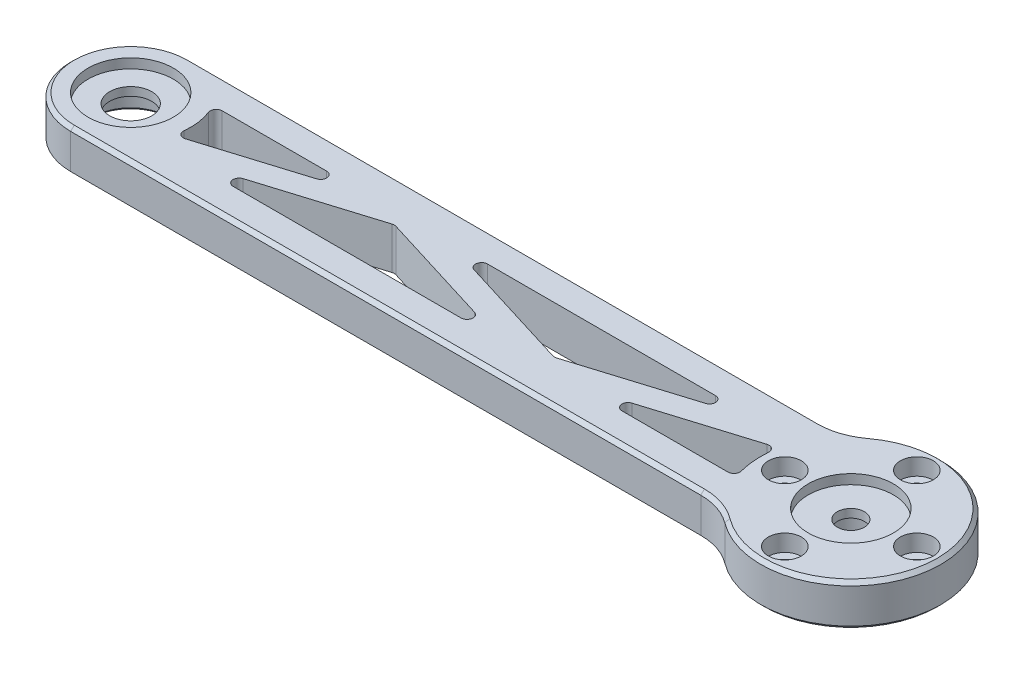
from build123d import *

# Parameters (mm, degrees)
SKETCH_1_R          = 1.35
EXTRUDE_1_DEPTH     = 7
FILLET_1_R          = 1
FILLET_2_R          = 1
FILLET_3_R          = 1
FILLET_4_R          = 1
FILLET_5_R          = 10
SKETCH_2_R          = 4
CUT_EXTRUDE_1_DEPTH = 4
SKETCH_3_R          = 6.1
CUT_EXTRUDE_2_DEPTH = 4
SKETCH_4_R          = 7.1
CUT_EXTRUDE_4_DEPTH = 1.6
SKETCH_5_R          = 7.1
CUT_EXTRUDE_5_DEPTH = 1.6
SKETCH_6_R          = 2.25
SKETCH_6_R_2        = 3.5
CUT_EXTRUDE_6_DEPTH = 5
CHAMFER_1_SIZE      = 0.6
CHAMFER_2_SIZE      = 0.5
SKETCH_7_R          = 2.75
CUT_EXTRUDE_7_DEPTH = 2.8


with BuildPart() as part:
    # 草图1 → 凸台-拉伸1 (new body)
    with BuildSketch(Plane(origin=(0, 0, 0), x_dir=(1, 0, 0), z_dir=(0, 1, 0))):
        with BuildLine():
            Line((-120, 10), (-11.180339887, 10))
            ThreePointArc((-11.180339887, 10), (15, 0), (-11.180339887, -10))
            Line((-11.180339887, -10), (-120, -10))
            ThreePointArc((-120, -10), (-130, 0), (-120, 10))
        make_face()
        with Locations(Location((-11, 0, 0), (0, 0, 270))):
            Circle(SKETCH_1_R, mode=Mode.SUBTRACT)
        with Locations(Location((0, 11, 0), (0, 0, 270))):
            Circle(SKETCH_1_R, mode=Mode.SUBTRACT)
        with Locations(Location((11, 0, 0), (0, 0, 270))):
            Circle(SKETCH_1_R, mode=Mode.SUBTRACT)
        with Locations(Location((0, -11, 0), (0, 0, 270))):
            Circle(SKETCH_1_R, mode=Mode.SUBTRACT)
        Polygon((-104.558275962, -5), (-53.32280907, -5), (-78.940542516, 2.906902245), align=None, mode=Mode.SUBTRACT)
        with BuildLine():
            Line((-111.339745962, 5), (-85.722012516, 5))
            Line((-85.722012516, 5), (-110.343778499, -2.599497322))
            ThreePointArc((-110.343778499, -2.599497322), (-110.084789012, 1.299457992), (-111.339745962, 5))
        make_face(mode=Mode.SUBTRACT)
        Polygon((-72.159072516, 5), (-46.54133907, -2.906902245), (-20.923605624, 5), align=None, mode=Mode.SUBTRACT)
        with BuildLine():
            Line((-39.75986907, -5), (-14.751545054, 2.71880829))
            ThreePointArc((-14.751545054, 2.71880829), (-14.953467696, -1.180594709), (-14.142135624, -5))
            Line((-14.142135624, -5), (-39.75986907, -5))
        make_face(mode=Mode.SUBTRACT)
    extrude(amount=EXTRUDE_1_DEPTH)

    # 圆角1
    fillet_1_edges = [part.edges().sort_by_distance(p)[0] for p in [
        (-85.722012516, 3.5, -5),
        (-111.339745962, 3.5, -5),
        (-110.343778499, 3.5, 2.599497322),
    ]]
    fillet(fillet_1_edges, radius=FILLET_1_R)

    # 圆角2
    fillet_2_edges = [part.edges().sort_by_distance(p)[0] for p in [
        (-104.558275962, 3.5, 5),
        (-53.32280907, 3.5, 5),
        (-78.940542516, 3.5, -2.906902245),
    ]]
    fillet(fillet_2_edges, radius=FILLET_2_R)

    # 圆角3
    fillet_3_edges = [part.edges().sort_by_distance(p)[0] for p in [
        (-46.54133907, 3.5, 2.906902245),
        (-20.923605624, 3.5, -5),
        (-72.159072516, 3.5, -5),
    ]]
    fillet(fillet_3_edges, radius=FILLET_3_R)

    # 圆角4
    fillet_4_edges = [part.edges().sort_by_distance(p)[0] for p in [
        (-39.75986907, 3.5, 5),
        (-14.142135624, 3.5, 5),
        (-14.751545054, 3.5, -2.71880829),
    ]]
    fillet(fillet_4_edges, radius=FILLET_4_R)

    # 圆角5
    fillet_5_edges = [part.edges().sort_by_distance(p)[0] for p in [
        (-11.180339887, 3.5, -10),
        (-11.180339887, 3.5, 10),
    ]]
    fillet(fillet_5_edges, radius=FILLET_5_R)

    # 草图2 → 切除-拉伸1 (cut)
    with BuildSketch(Plane(origin=(0, 0, 0), x_dir=(-1, 0, 0), z_dir=(0, -1, 0))):
        with Locations(Location((0, 0, 0), (0, 0, 90))):
            Circle(SKETCH_2_R)
    extrude(amount=-CUT_EXTRUDE_1_DEPTH, mode=Mode.SUBTRACT)

    # 草图3 → 切除-拉伸2 (cut)
    with BuildSketch(Plane(origin=(0, 0, 0), x_dir=(-1, 0, 0), z_dir=(0, -1, 0))):
        with Locations(Location((120, 0, 0), (0, 0, 90))):
            Circle(SKETCH_3_R)
    extrude(amount=-CUT_EXTRUDE_2_DEPTH, mode=Mode.SUBTRACT)

    # 草图4 → 切除-拉伸4 (cut)
    with BuildSketch(Plane(origin=(0, 7, 0), x_dir=(1, 0, 0), z_dir=(0, 1, 0))):
        with Locations(Location((0, 0, 0), (0, 0, 270))):
            Circle(SKETCH_4_R)
    extrude(amount=-CUT_EXTRUDE_4_DEPTH, mode=Mode.SUBTRACT)

    # 草图5 → 切除-拉伸5 (cut)
    with BuildSketch(Plane(origin=(0, 7, 0), x_dir=(1, 0, 0), z_dir=(0, 1, 0))):
        with Locations(Location((-120, 0, 0), (0, 0, 270))):
            Circle(SKETCH_5_R)
    extrude(amount=-CUT_EXTRUDE_5_DEPTH, mode=Mode.SUBTRACT)

    # 草图6 → 切除-拉伸6 (cut, symmetric)
    with BuildSketch(Plane(origin=(0, 5.4, 0), x_dir=(1, 0, 0), z_dir=(0, 1, 0))):
        with Locations(Location((0, 0, 0), (0, 0, 270))):
            Circle(SKETCH_6_R)
        with Locations(Location((-120, 0, 0), (0, 0, 270))):
            Circle(SKETCH_6_R_2)
    extrude(amount=CUT_EXTRUDE_6_DEPTH, both=True, mode=Mode.SUBTRACT)

    # 倒角1
    chamfer_1_edges = [part.edges().sort_by_distance(p)[0] for p in [
        (15, 0, 0),
        (15, 7, 0),
        (-11.83772234, 0, 10.513167019),
        (-11.83772234, 7, 10.513167019),
        (-11.83772234, 0, -10.513167019),
        (-11.83772234, 7, -10.513167019),
        (-130, 0, 0),
        (-67.5, 0, -10),
        (-67.5, 0, 10),
        (-67.5, 7, 10),
        (-67.5, 7, -10),
        (-130, 7, 0),
    ]]
    chamfer(chamfer_1_edges, length=CHAMFER_1_SIZE)

    # 倒角2
    chamfer_2_edges = [part.edges().sort_by_distance(p)[0] for p in [
        (-120, 0, 6.1),
    ]]
    chamfer(chamfer_2_edges, length=CHAMFER_2_SIZE)

    # 草图7 → 切除-拉伸7 (cut)
    with BuildSketch(Plane(origin=(0, 7, 0), x_dir=(1, 0, 0), z_dir=(0, 1, 0))):
        with Locations(Location((0, 11, 0), (0, 0, 270))):
            Circle(SKETCH_7_R)
        with Locations(Location((11, 0, 0), (0, 0, 270))):
            Circle(SKETCH_7_R)
        with Locations(Location((0, -11, 0), (0, 0, 270))):
            Circle(SKETCH_7_R)
        with Locations(Location((-11, 0, 0), (0, 0, 270))):
            Circle(SKETCH_7_R)
    extrude(amount=-CUT_EXTRUDE_7_DEPTH, mode=Mode.SUBTRACT)


solid = part.part
